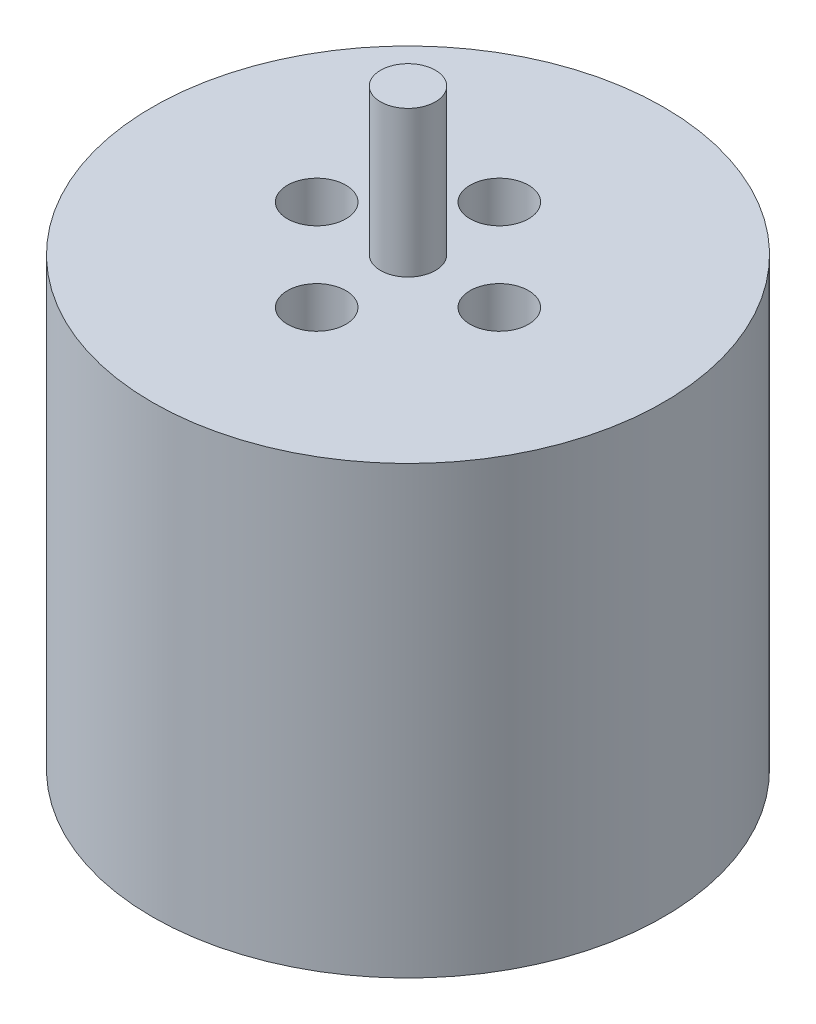
from build123d import *

# Parameters (mm, degrees)
SKETCH1_R           = 7
BOSS_EXTRUDE1_DEPTH = 6.1
SKETCH2_R           = 0.75
BOSS_EXTRUDE2_DEPTH = 1
BOSS_EXTRUDE3_START = 4
SKETCH3_R           = 0.75
BOSS_EXTRUDE3_DEPTH = 4
SKETCH4_R           = 0.8
CUT_EXTRUDE1_DEPTH  = 2
SKETCH5_R           = 0.8
CUT_EXTRUDE2_DEPTH  = 2


with BuildPart() as part:
    # Sketch1 → Boss-Extrude1 (new, symmetric)
    with BuildSketch(Plane(origin=(0, 0, 0), x_dir=(1, 0, 0), z_dir=(0, 1, 0))):
        with Locations(Location((0, 0, 0), (0, 0, 270))):
            Circle(SKETCH1_R)
    extrude(amount=BOSS_EXTRUDE1_DEPTH, both=True)

    # Sketch2 → Boss-Extrude2 (add)
    with BuildSketch(Plane.XZ.offset(6.1)):
        with Locations(Location((0, 0, 0), (0, 0, 90))):
            Circle(SKETCH2_R)
    extrude(amount=BOSS_EXTRUDE2_DEPTH)

    # Sketch3 → Boss-Extrude3 (add)
    with BuildSketch(Plane(origin=(0, 6.1, 0), x_dir=(1, 0, 0), z_dir=(0, 1, 0)).offset(BOSS_EXTRUDE3_START)):
        with Locations(Location((0, 0, 0), (0, 0, 270))):
            Circle(SKETCH3_R)
    extrude(amount=-BOSS_EXTRUDE3_DEPTH)

    # Sketch4 → Cut-Extrude1 (cut)
    with BuildSketch(Plane.XZ.offset(6.1)):
        with Locations(Location((0, 4.5, 0), (0, 0, 270))):
            Circle(SKETCH4_R)
        with Locations(Location((4.5, 0, 0), (0, 0, 270))):
            Circle(SKETCH4_R)
        with Locations(Location((0, -4.5, 0), (0, 0, 270))):
            Circle(SKETCH4_R)
        with Locations(Location((-4.5, 0, 0), (0, 0, 270))):
            Circle(SKETCH4_R)
    extrude(amount=-CUT_EXTRUDE1_DEPTH, mode=Mode.SUBTRACT)

    # Sketch5 → Cut-Extrude2 (cut)
    with BuildSketch(Plane(origin=(0, 6.1, 0), x_dir=(1, 0, 0), z_dir=(0, 1, 0))):
        with Locations(Location((2.5, 0, 0), (0, 0, 270))):
            Circle(SKETCH5_R)
        with Locations(Location((0, -2.5, 0), (0, 0, 270))):
            Circle(SKETCH5_R)
        with Locations(Location((-2.5, 0, 0), (0, 0, 270))):
            Circle(SKETCH5_R)
        with Locations(Location((0, 2.5, 0), (0, 0, 270))):
            Circle(SKETCH5_R)
    extrude(amount=-CUT_EXTRUDE2_DEPTH, mode=Mode.SUBTRACT)


solid = part.part
